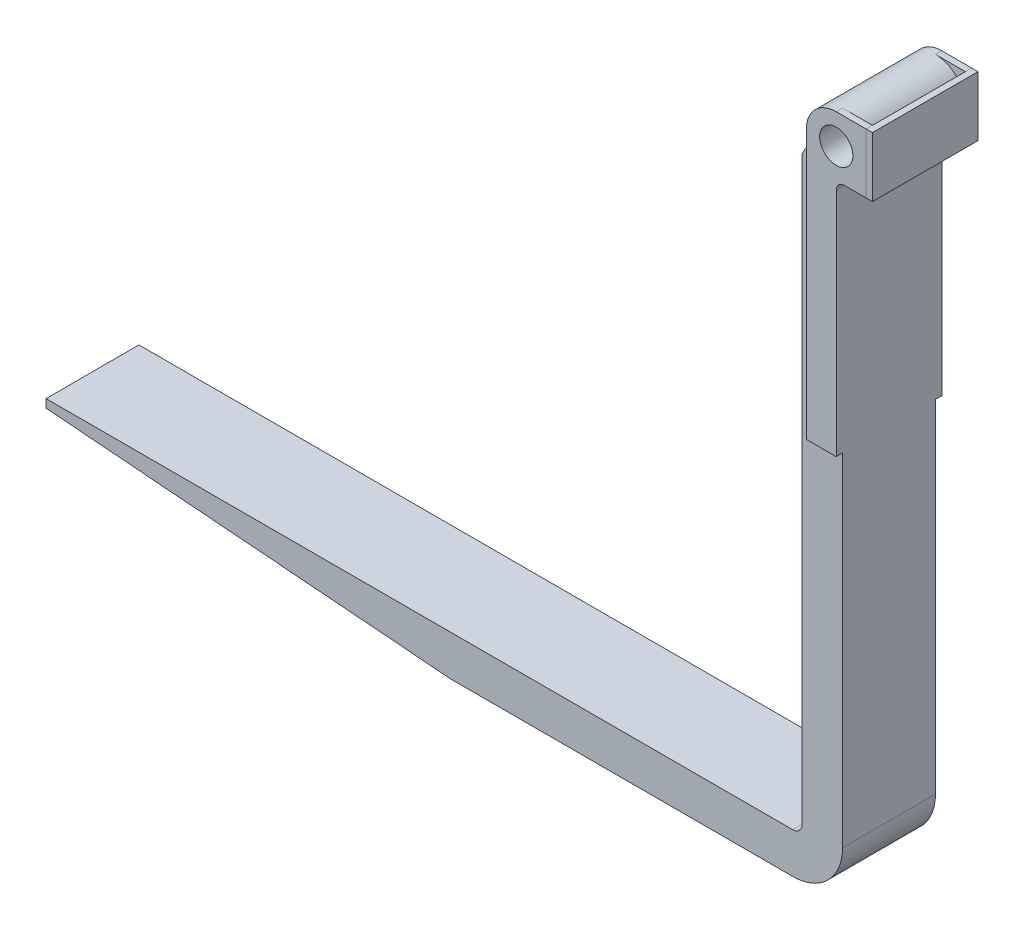
from build123d import *

# Parameters (mm, degrees)
EXTRUDE_THIN1_DEPTH     = 70
CUT_EXTRUDE1_DEPTH      = 1537.912489376
CUT_EXTRUDE1_DEPTH_BACK = 1537.912489376
SKETCH3_R               = 45
SKETCH3_R_2             = 25
BOSS_EXTRUDE1_DEPTH     = 70
BOSS_EXTRUDE2_DEPTH     = 70
SKETCH5_R               = 45
SKETCH5_R_2             = 25
BOSS_EXTRUDE3_DEPTH     = 9.5
SKETCH6_W               = 159
SKETCH6_H               = 90
BOSS_EXTRUDE4_DEPTH     = 9.5


with BuildPart() as part:
    # Sketch1 → Extrude-Thin1 (new, symmetric)
    with BuildSketch(Plane.XY):
        with BuildLine():
            Line((0, 950), (0, 75))
            ThreePointArc((0, 75), (-21.966991411, 21.966991411), (-75, 0))
            Line((-75, 0), (-1200, 0))
            Line((-1200, 0), (-1200, 61))
            Line((-1200, 61), (-75, 61))
            ThreePointArc((-75, 61), (-65.100505063, 65.100505063), (-61, 75))
            Line((-61, 75), (-61, 950))
            Line((-61, 950), (0, 950))
        make_face()
    extrude(amount=EXTRUDE_THIN1_DEPTH, both=True)

    # Sketch2 → Cut-Extrude1 (cut, two sides: drawn at the far end of the back side and taken through both)
    with BuildSketch(Plane.XY.offset(70).offset(-CUT_EXTRUDE1_DEPTH_BACK)):
        Polygon((-4202.326226889, 287.209544269), (-1200, 48.5), (-590, 0), (2412.326226889, -238.709544269), (1934.907138351, -6243.361998046), (-4679.745315427, -5717.442909508), align=None)
    extrude(amount=CUT_EXTRUDE1_DEPTH + CUT_EXTRUDE1_DEPTH_BACK, mode=Mode.SUBTRACT)



with BuildPart() as body_2:
    # Sketch3 → Boss-Extrude1 (new, symmetric)
    with BuildSketch(Plane.XY):
        with Locations((0, 995)):
            Circle(SKETCH3_R)
        with Locations((0, 995)):
            Circle(SKETCH3_R_2, mode=Mode.SUBTRACT)
    extrude(amount=BOSS_EXTRUDE1_DEPTH, both=True)


with BuildPart() as body_3:
    # Sketch4 → Boss-Extrude2 (new, symmetric)
    with BuildSketch(Plane.XY):
        with BuildLine():
            Line((-61, 950), (0, 950))
            ThreePointArc((0, 950), (-26.815976936, 958.862714809), (-43.069182498, 981.959849736))
            Line((-43.069182498, 981.959849736), (-61, 950))
        make_face()
    extrude(amount=BOSS_EXTRUDE2_DEPTH, both=True)


with BuildPart() as part_1:
    add(part.part)

    add(body_2.part)  # Boss-Extrude3 merges body 2

    add(body_3.part)  # Boss-Extrude3 merges body 3
    # Sketch5 → Boss-Extrude3 (add)
    # profile 1 of 3: a face of its own
    with BuildSketch(Plane.XY.offset(70)):
        with BuildLine():
            Line((45, 1040), (0, 1040))
            ThreePointArc((0, 1040), (31.819805153, 1026.819805153), (45, 995))
            Line((45, 995), (45, 1040))
        make_face()
    # profile 2 of 3: a face of its own
    with BuildSketch(Plane.XY.offset(70)):
        with Locations((0, 995)):
            Circle(SKETCH5_R)
        with Locations((0, 995)):
            Circle(SKETCH5_R_2, mode=Mode.SUBTRACT)
    # profile 3 of 3: a face of its own
    with BuildSketch(Plane.XY.offset(70)):
        with BuildLine():
            ThreePointArc((45, 995), (0, 950), (-45, 995))
            Line((-45, 995), (-45, 590))
            Line((-45, 590), (0, 590))
            Line((0, 590), (0, 937.5))
            ThreePointArc((0, 937.5), (3.661165235, 946.338834765), (12.5, 950))
            Line((12.5, 950), (45, 950))
            Line((45, 950), (45, 995))
        make_face()
    boss_extrude3 = extrude(amount=BOSS_EXTRUDE3_DEPTH)

    # Mirror1: Boss-Extrude3 across plane
    add(boss_extrude3.mirror(Plane.XY))


with BuildPart() as body_2_2:
    # Sketch6 → Boss-Extrude4 (new body)
    with BuildSketch(Plane(origin=(45, 0, 0), x_dir=(0, 0, -1), z_dir=(1, 0, 0))):
        with Locations((0, 995)):
            Rectangle(SKETCH6_W, SKETCH6_H)
    extrude(amount=BOSS_EXTRUDE4_DEPTH)


solid = Compound([part_1.part, body_2_2.part])
